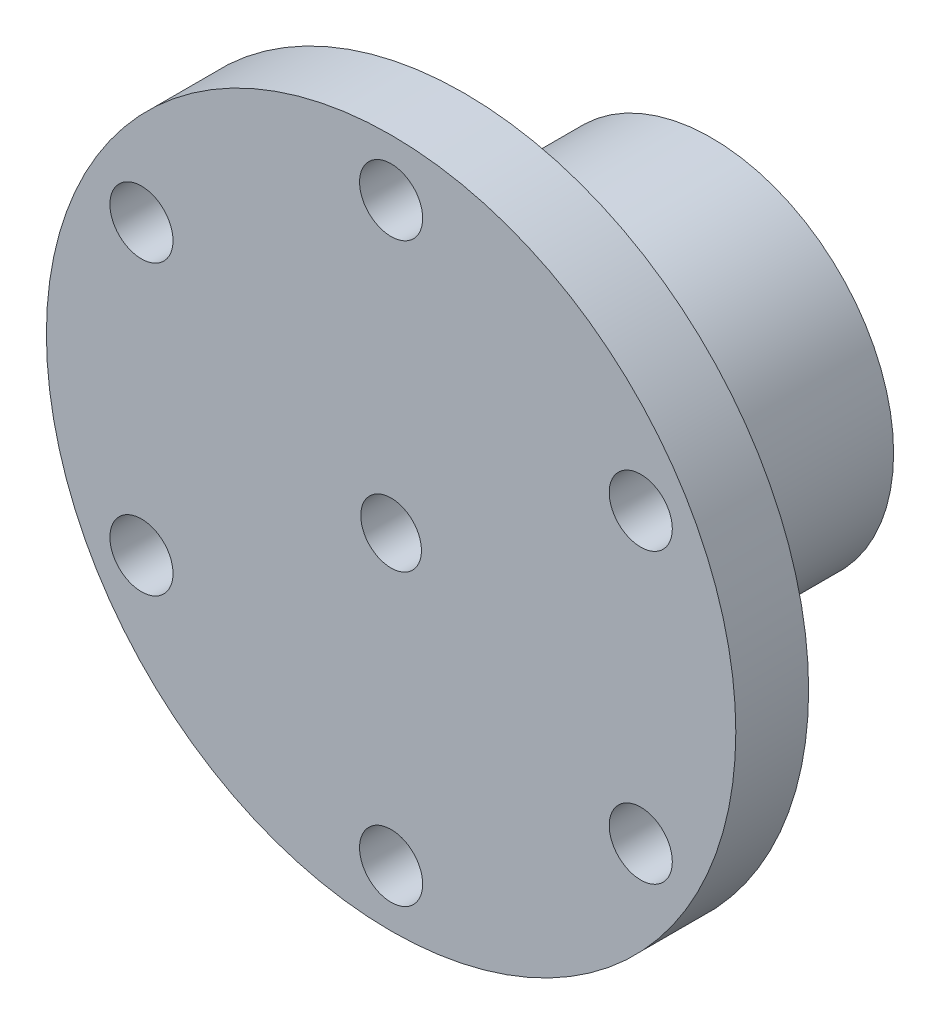
from build123d import *

# Parameters (mm, degrees)
SKETCH_2_R          = 2.5
CUT_EXTRUDE_1_DEPTH = 49.063291606
SKETCH_3_R          = 3
CUT_EXTRUDE_2_DEPTH = 49.063291606
SKETCH_4_R          = 2.6
CUT_EXTRUDE_3_DEPTH = 49.063291661


with BuildPart() as part:
    # 草图1 → 旋转1 (revolve)
    with BuildSketch(Plane(origin=(0, 0, 0), x_dir=(1, 0, 0), z_dir=(0, 1, 0))):
        Polygon((0, 0), (0, 26.4), (15, 26.4), (15, 6), (28.4, 6), (28.4, 0), align=None)
    revolve(axis=Axis((0, 0, 0), (0, 0, -1)))

    # 草图2 → 切除-拉伸1 (cut, through all)
    with BuildSketch(Plane(origin=(0, 0, -26.4), x_dir=(-1, 0, 0), z_dir=(0, 0, -1))):
        Circle(SKETCH_2_R)
    extrude(amount=-CUT_EXTRUDE_1_DEPTH, mode=Mode.SUBTRACT)

    # 草图3 → 切除-拉伸2 (cut, through all)
    with BuildSketch(Plane(origin=(0, 0, 0), x_dir=(1, 0, 0), z_dir=(0, 1, 0))):
        with Locations(Location((0, 14.370233869, 0), (0, 0, 270))):
            Circle(SKETCH_3_R)
    extrude(amount=-CUT_EXTRUDE_2_DEPTH, mode=Mode.SUBTRACT)

    # 草图4 → 切除-拉伸3 (cut, through all)
    with BuildSketch(Plane.XY):
        with Locations((0, 23.75)):
            Circle(SKETCH_4_R)
        with Locations((20.56810334, 11.875)):
            Circle(SKETCH_4_R)
        with Locations((20.56810334, -11.875)):
            Circle(SKETCH_4_R)
        with Locations((0, -23.75)):
            Circle(SKETCH_4_R)
        with Locations((-20.56810334, -11.875)):
            Circle(SKETCH_4_R)
        with Locations((-20.56810334, 11.875)):
            Circle(SKETCH_4_R)
    extrude(amount=-CUT_EXTRUDE_3_DEPTH, mode=Mode.SUBTRACT)


solid = part.part
